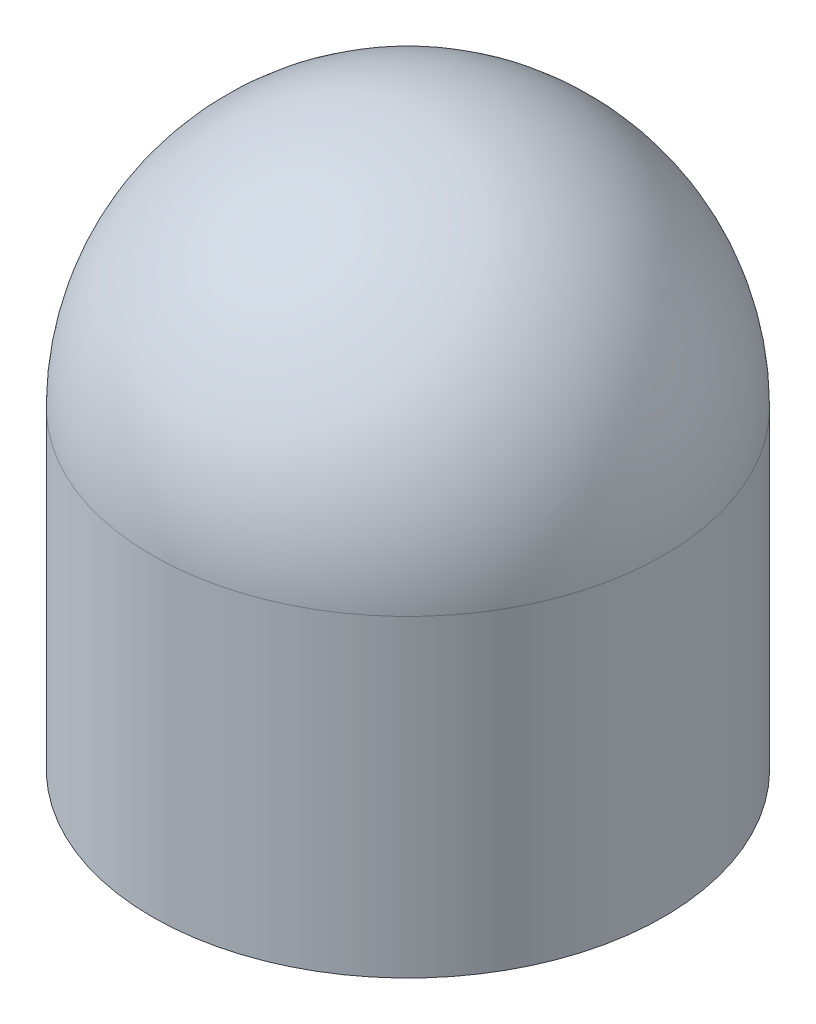
from build123d import *

# Parameters (mm, degrees)
SKETCH2_R           = 24.5
BOSS_EXTRUDE1_DEPTH = 30
REVOLVE_THIN1_ANGLE = 180
SKETCH6_R           = 22.9
CUT_EXTRUDE1_DEPTH  = 30


with BuildPart() as part:
    # Sketch2 → Boss-Extrude1 (new body)
    with BuildSketch(Plane(origin=(0, 0, 0), x_dir=(1, 0, 0), z_dir=(0, 1, 0))):
        with Locations(Location((0, 0, 0), (0, 0, 270))):
            Circle(SKETCH2_R)
    extrude(amount=BOSS_EXTRUDE1_DEPTH)

    # Sketch4 → Revolve-Thin1 (revolve)
    with BuildSketch(Plane(origin=(0, 30, 0), x_dir=(1, 0, 0), z_dir=(0, 1, 0))):
        with BuildLine():
            ThreePointArc((24.5, 0), (0, -24.5), (-24.5, 0))
            Line((-24.5, 0), (-22.5, 0))
            ThreePointArc((-22.5, 0), (0, -22.5), (22.5, 0))
            Line((22.5, 0), (24.5, 0))
        make_face()
    revolve(axis=Axis((0, 30, 0), (-1, 0, 0)), revolution_arc=REVOLVE_THIN1_ANGLE)

    # Sketch6 → Cut-Extrude1 (cut)
    with BuildSketch(Plane.XZ):
        with Locations(Location((0, 0, 0), (0, 0, 270))):
            Circle(SKETCH6_R)
    extrude(amount=-CUT_EXTRUDE1_DEPTH, mode=Mode.SUBTRACT)


solid = part.part
